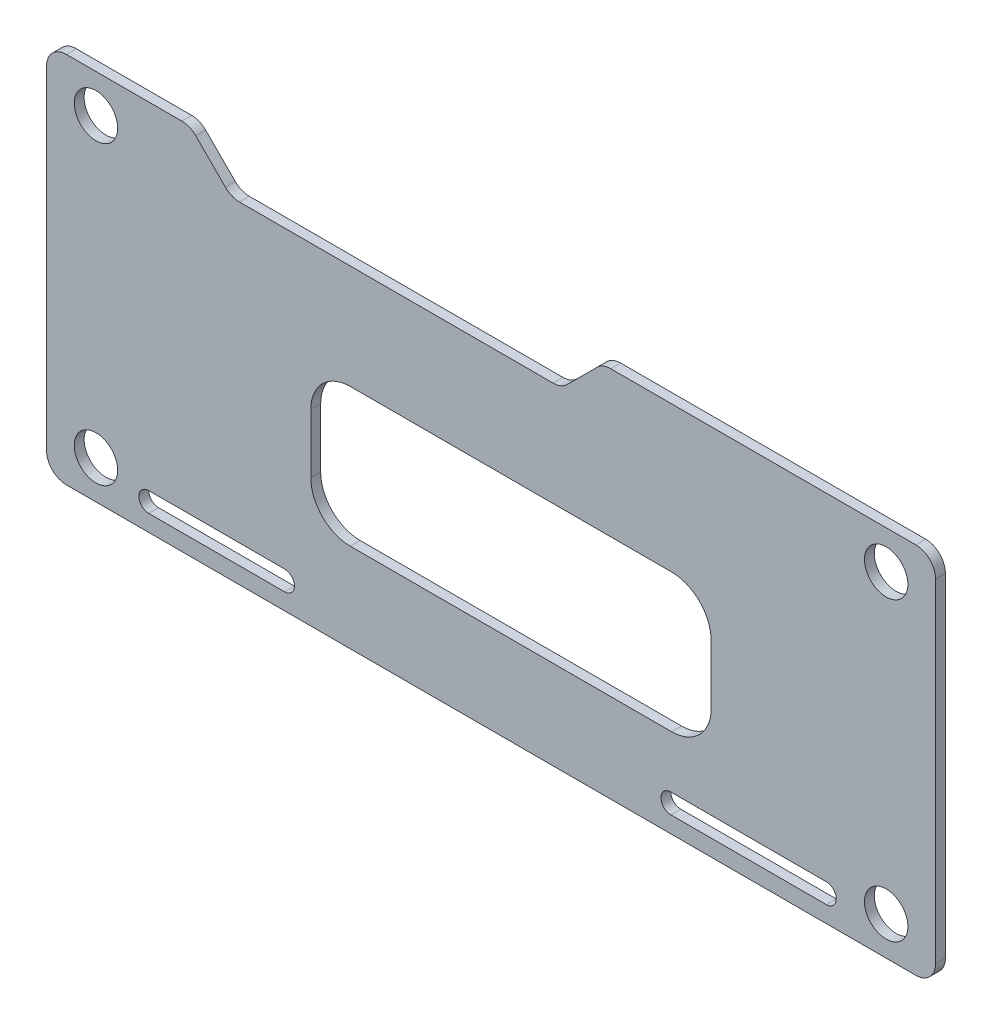
from build123d import *

# Parameters (mm, degrees)
SKETCH_1_W          = 45
SKETCH_1_H          = 18.871619184
SKETCH_1_R          = 1.1
EXTRUDE_1_DEPTH     = 0.5
SKETCH_2_W          = 20.265588098
SKETCH_2_H          = 7.002088202
CUT_EXTRUDE_1_DEPTH = 1.5
FILLET_1_R          = 1
FILLET_2_R          = 1
FILLET_3_R          = 2


with BuildPart() as part:
    # 草图1 → 凸台-拉伸1 (new body)
    with BuildSketch(Plane.XY):
        with Locations((-1.488440653, 2.400990099)):
            Rectangle(SKETCH_1_W, SKETCH_1_H)
        with Locations((-21.488440653, 9.900990099)):
            Circle(SKETCH_1_R, mode=Mode.SUBTRACT)
        with Locations((-21.488440653, -5.099009901)):
            Circle(SKETCH_1_R, mode=Mode.SUBTRACT)
        with Locations((18.511559347, -5.099009901)):
            Circle(SKETCH_1_R, mode=Mode.SUBTRACT)
        with Locations((18.511559347, 9.900990099)):
            Circle(SKETCH_1_R, mode=Mode.SUBTRACT)
    extrude(amount=EXTRUDE_1_DEPTH)

    # 草图2 → 切除-拉伸1 (cut)
    with BuildSketch(Plane.XY.offset(0.5)):
        Polygon((-16.728608447, 11.836799691), (-14.639805099, 9.747996342), (2.071462084, 9.747996342), (5.519738876, 13.196273134), (-14.871851344, 13.196273134), align=None)
        with Locations((-0.480960338, 0.9646533)):
            Rectangle(SKETCH_2_W, SKETCH_2_H)
        with BuildLine():
            Line((-18.815905025, -5.198806117), (-11.940354626, -5.198806117))
            ThreePointArc((-11.940354626, -5.198806117), (-11.440354626, -5.698806117), (-11.940354626, -6.198806117))
            Line((-11.940354626, -6.198806117), (-18.815905025, -6.198806117))
            ThreePointArc((-18.815905025, -6.198806117), (-19.315905025, -5.698806117), (-18.815905025, -5.198806117))
        make_face()
        with BuildLine():
            Line((7.610434302, -5.198806117), (15.484383172, -5.198806117))
            ThreePointArc((15.484383172, -5.198806117), (15.984383172, -5.698806117), (15.484383172, -6.198806117))
            Line((15.484383172, -6.198806117), (7.610434302, -6.198806117))
            ThreePointArc((7.610434302, -6.198806117), (7.110434302, -5.698806117), (7.610434302, -5.198806117))
        make_face()
    extrude(amount=-CUT_EXTRUDE_1_DEPTH, mode=Mode.SUBTRACT)

    # 圆角1
    fillet_1_edges = [part.edges().sort_by_distance(p)[0] for p in [
        (-16.728608447, 11.836799691, 0.25),
        (4.160265432, 11.836799691, 0.25),
        (2.071462084, 9.747996342, 0.25),
        (-14.639805099, 9.747996342, 0.25),
    ]]
    fillet(fillet_1_edges, radius=FILLET_1_R)

    # 圆角2
    fillet_2_edges = [part.edges().sort_by_distance(p)[0] for p in [
        (21.011559347, -7.034819493, 0.25),
        (-23.988440653, -7.034819493, 0.25),
        (-23.988440653, 11.836799691, 0.25),
        (21.011559347, 11.836799691, 0.25),
    ]]
    fillet(fillet_2_edges, radius=FILLET_2_R)

    # 圆角3
    fillet_3_edges = [part.edges().sort_by_distance(p)[0] for p in [
        (9.651833711, 4.465697401, 0.25),
        (9.651833711, -2.536390801, 0.25),
        (-10.613754387, -2.536390801, 0.25),
        (-10.613754387, 4.465697401, 0.25),
    ]]
    fillet(fillet_3_edges, radius=FILLET_3_R)


solid = part.part
